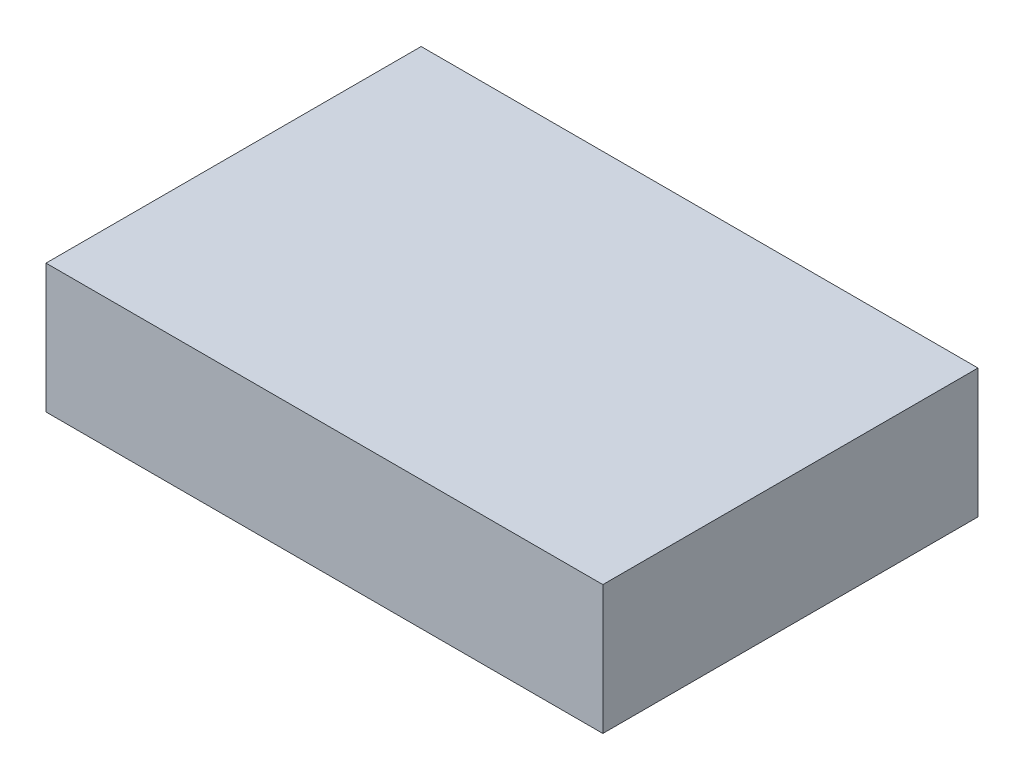
from build123d import *

# Parameters (mm, degrees)
SKETCH1_W           = 95
SKETCH1_H           = 64
BOSS_EXTRUDE1_DEPTH = 22


with BuildPart() as part:
    # Sketch1 → Boss-Extrude1 (new body)
    with BuildSketch(Plane(origin=(0, 0, 0), x_dir=(1, 0, 0), z_dir=(0, 1, 0))):
        Rectangle(SKETCH1_W, SKETCH1_H)
    extrude(amount=BOSS_EXTRUDE1_DEPTH)


solid = part.part
